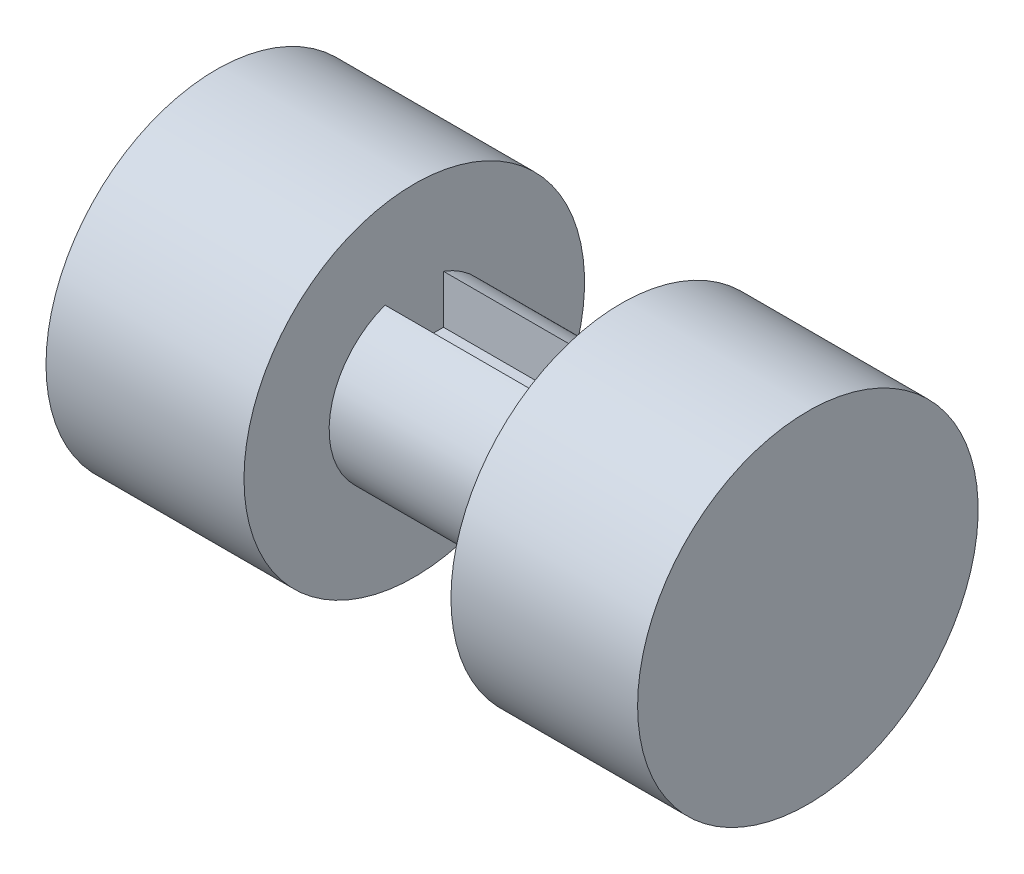
from build123d import *

# Parameters (mm, degrees)
ENL_V_START             = 20
ESQUISSE2_W             = 45.995149175
ESQUISSE2_H             = 13
ENL_V_MAT_EXTRU_1_DEPTH = 13


with BuildPart() as part:
    # Esquisse1 → Révolution1 (revolve)
    with BuildSketch(Plane.XY, mode=Mode.PRIVATE) as r_volution1_sk:
        Polygon((-44.003614869, 0), (87.477059288, 0), (87.477059288, 37.843146067), (45.995149175, 37.843146067), (45.995149175, 18.921573034), (0, 18.921573034), (0, 37.843146067), (-44.003614869, 37.843146067), align=None)
    revolve(r_volution1_sk.sketch.rotate(Axis((-44.003614869, 0, 0), (1, 0, 0)), 90), axis=Axis((-44.003614869, 0, 0), (1, 0, 0)))

    # Esquisse2 → Enlèv. mat.-Extru.1 (cut)
    with BuildSketch(Plane(origin=(0, 0, 0), x_dir=(1, 0, 0), z_dir=(0, 1, 0)).offset(ENL_V_START)):
        with Locations((22.997574588, 0)):
            Rectangle(ESQUISSE2_W, ESQUISSE2_H)
    extrude(amount=-ENL_V_MAT_EXTRU_1_DEPTH, mode=Mode.SUBTRACT)


solid = part.part
